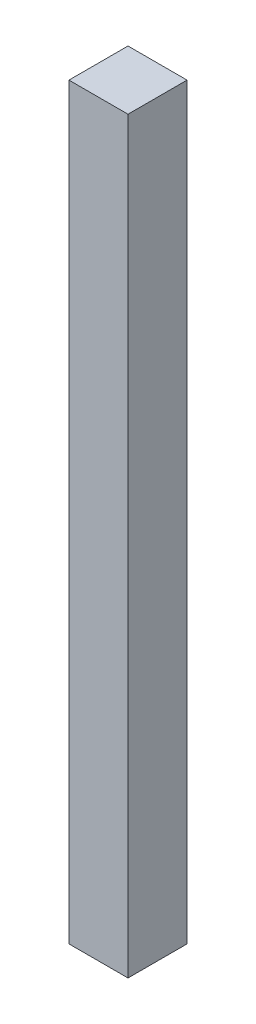
from build123d import *

# Parameters (mm, degrees)
SKETCH1_W           = 15
SKETCH1_H           = 15
BOSS_EXTRUDE1_DEPTH = 190


with BuildPart() as part:
    # Sketch1 → Boss-Extrude1 (new body)
    with BuildSketch(Plane(origin=(0, 0, 0), x_dir=(1, 0, 0), z_dir=(0, 1, 0))):
        with Locations((7.5, 7.5)):
            Rectangle(SKETCH1_W, SKETCH1_H)
    extrude(amount=BOSS_EXTRUDE1_DEPTH)


solid = part.part
